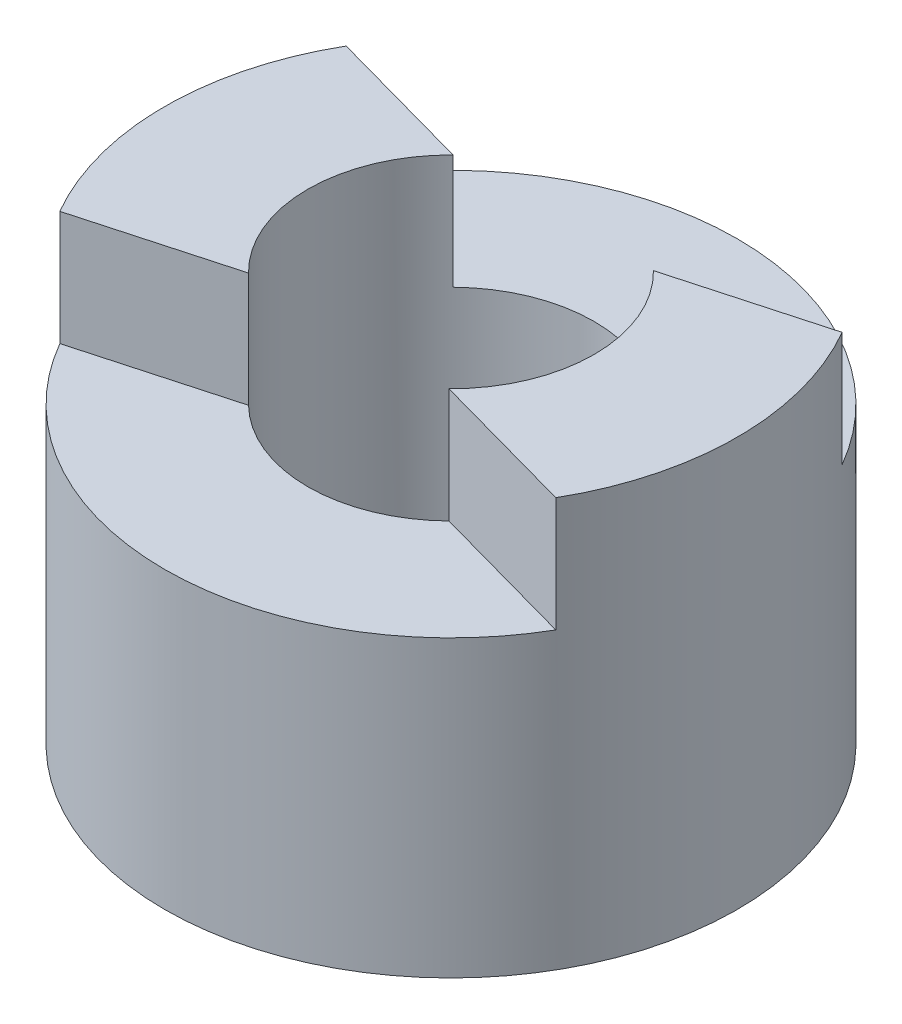
from build123d import *

# Parameters (mm, degrees)
SKETCH1_R           = 35
SKETCH1_R_2         = 17.5
BOSS_EXTRUDE1_DEPTH = 50
CUT_EXTRUDE1_START  = -14
CUT_EXTRUDE1_DEPTH  = 14


with BuildPart() as part:
    # Sketch1 → Boss-Extrude1 (new body)
    with BuildSketch(Plane(origin=(0, 0, 0), x_dir=(1, 0, 0), z_dir=(0, 1, 0))):
        with Locations(Location((0, 0, 0), (0, 0, 270))):
            Circle(SKETCH1_R)
        with Locations(Location((0, 0, 0), (0, 0, 270))):
            Circle(SKETCH1_R_2, mode=Mode.SUBTRACT)
    extrude(amount=BOSS_EXTRUDE1_DEPTH)

    # Sketch2 → Cut-Extrude1 (cut)
    with BuildSketch(Plane(origin=(0, 50, 0), x_dir=(1, 0, 0), z_dir=(0, 1, 0)).offset(CUT_EXTRUDE1_START)):
        with BuildLine():
            Line((12.247448714, -12.5), (30.310889132, -17.5))
            ThreePointArc((30.310889132, -17.5), (0, -35), (-30.310889132, -17.5))
            Line((-30.310889132, -17.5), (-12.247448714, -12.5))
            ThreePointArc((-12.247448714, -12.5), (0, -17.5), (12.247448714, -12.5))
        make_face()
    cut_extrude1 = extrude(amount=CUT_EXTRUDE1_DEPTH, mode=Mode.SUBTRACT)

    # Mirror1: Cut-Extrude1 across plane
    add(cut_extrude1.mirror(Plane.XY), mode=Mode.SUBTRACT)


solid = part.part
